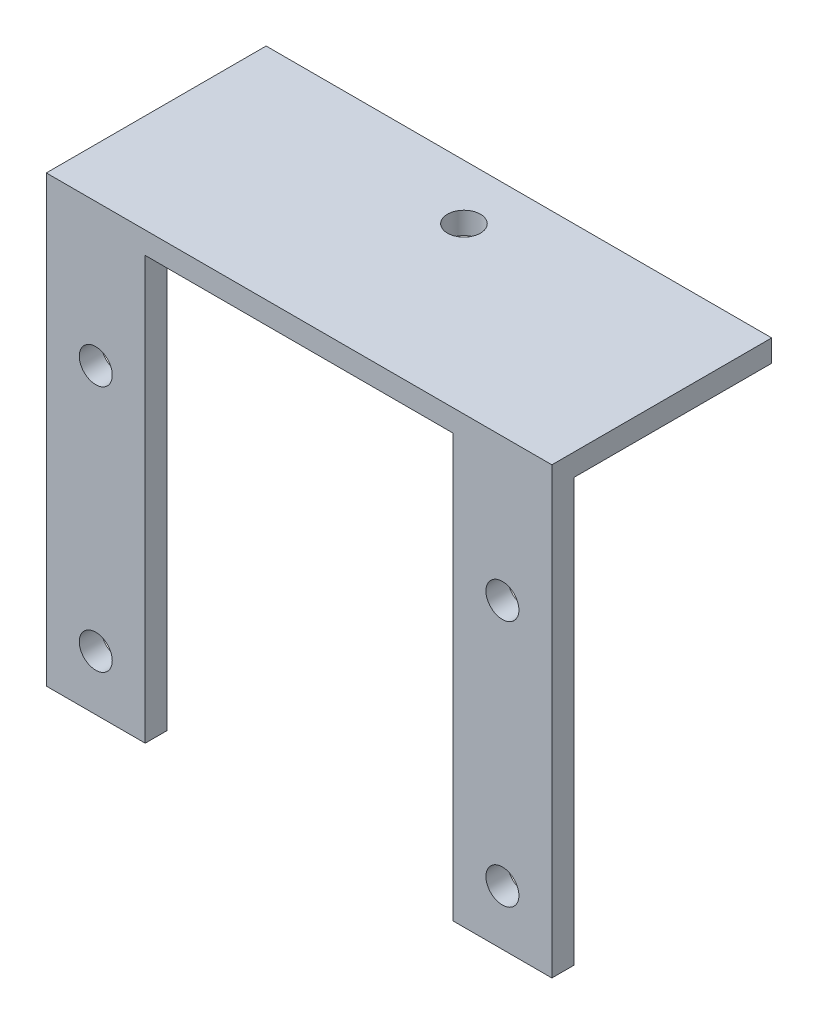
from build123d import *

# Parameters (mm, degrees)
SKETCH3_W             = 9
SKETCH3_H             = 40
SKETCH3_R             = 1.5
BOSS_EXTRUDE5_DEPTH   = 2
BOSS_EXTRUDE5_2_DEPTH = 2
SKETCH5_W             = 46
SKETCH5_H             = 20
SKETCH5_R             = 1.5
BOSS_EXTRUDE7_DEPTH   = 2


with BuildPart() as part:
    # Sketch3 → Boss-Extrude5 (new body)
    with BuildSketch(Plane.XY):
        with Locations((-21.015808288, -14.438328765)):
            Rectangle(SKETCH3_W, SKETCH3_H)
        with Locations((-21.015808288, -29.438328765)):
            Circle(SKETCH3_R, mode=Mode.SUBTRACT)
        with Locations((-21.015808288, -6.938328765)):
            Circle(SKETCH3_R, mode=Mode.SUBTRACT)
    extrude(amount=BOSS_EXTRUDE5_DEPTH)



with BuildPart() as body_2:
    # Sketch3 → Boss-Extrude5 2 (new body)
    with BuildSketch(Plane.XY):
        with Locations((15.984191712, -14.438328765)):
            Rectangle(SKETCH3_W, SKETCH3_H)
        with Locations((15.984191712, -29.438328765)):
            Circle(SKETCH3_R, mode=Mode.SUBTRACT)
        with Locations((15.984191712, -6.938328765)):
            Circle(SKETCH3_R, mode=Mode.SUBTRACT)
    extrude(amount=BOSS_EXTRUDE5_2_DEPTH)


with BuildPart() as part_1:
    add(part.part)

    add(body_2.part)  # Boss-Extrude7 merges body 2
    # Sketch5 → Boss-Extrude7 (add)
    with BuildSketch(Plane(origin=(0, 4, 0), x_dir=(1, 0, 0), z_dir=(0, 1, 0))):
        with Locations((-2.515808288, 8)):
            Rectangle(SKETCH5_W, SKETCH5_H)
        with Locations(Location((-2.515808288, 13, 0), (0, 0, 270))):
            Circle(SKETCH5_R, mode=Mode.SUBTRACT)
    extrude(amount=BOSS_EXTRUDE7_DEPTH)


solid = part_1.part
